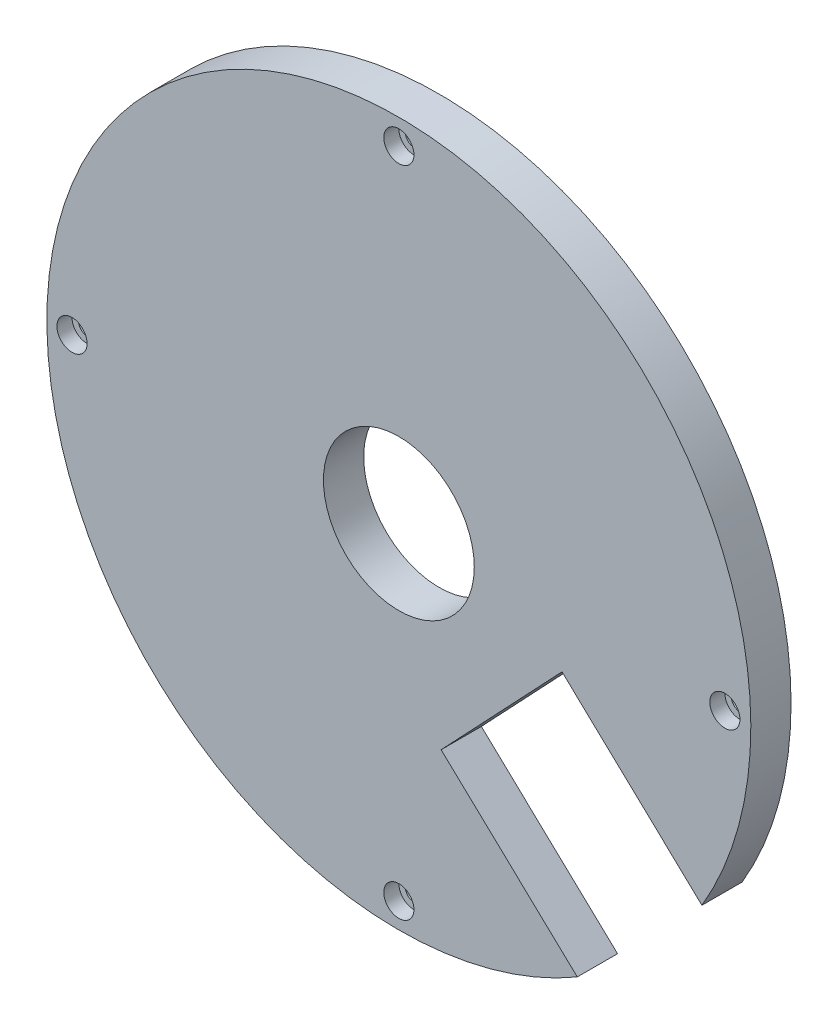
from build123d import *

# Parameters (mm, degrees)
SKIZZE1_R                       = 70
SKIZZE1_R_2                     = 15
AUFSATZ_LINEAR_AUSTRAGEN1_DEPTH = 8
SKIZZE2_R                       = 1.7
SCHNITT_LINEAR_AUSTRAGEN1_DEPTH = 8
SKIZZE3_R                       = 3
SCHNITT_LINEAR_AUSTRAGEN2_DEPTH = 3
SCHNITT_LINEAR_AUSTRAGEN3_DEPTH = 8


with BuildPart() as part:
    # Skizze1 → Aufsatz-Linear austragen1 (new body)
    with BuildSketch(Plane(origin=(0, 0, 0), x_dir=(0, 1, 0), z_dir=(0, 0, 1))):
        with Locations(Location((0, 0, 0), (0, 0, 270))):
            Circle(SKIZZE1_R)
        with Locations(Location((0, 0, 0), (0, 0, 270))):
            Circle(SKIZZE1_R_2, mode=Mode.SUBTRACT)
    extrude(amount=AUFSATZ_LINEAR_AUSTRAGEN1_DEPTH)

    # Skizze2 → Schnitt-Linear austragen1 (cut)
    with BuildSketch(Plane.XY.offset(8)):
        with Locations((0, 65)):
            Circle(SKIZZE2_R)
        with Locations((64.837196687, 0.18986002)):
            Circle(SKIZZE2_R)
        with Locations((0, -65)):
            Circle(SKIZZE2_R)
        with Locations((-65, 0)):
            Circle(SKIZZE2_R)
    extrude(amount=-SCHNITT_LINEAR_AUSTRAGEN1_DEPTH, mode=Mode.SUBTRACT)

    # Skizze3 → Schnitt-Linear austragen2 (cut)
    with BuildSketch(Plane.XY.offset(8)):
        with Locations((0, 65)):
            Circle(SKIZZE3_R)
        with Locations((64.837196687, 0.18986002)):
            Circle(SKIZZE3_R)
        with Locations((0, -65)):
            Circle(SKIZZE3_R)
        with Locations((-65, 0)):
            Circle(SKIZZE3_R)
    extrude(amount=-SCHNITT_LINEAR_AUSTRAGEN2_DEPTH, mode=Mode.SUBTRACT)

    # Skizze4 → Schnitt-Linear austragen3 (cut)
    with BuildSketch(Plane.XY.offset(8)):
        Polygon((66.550324449, -89.690139622), (8.405353871, -34.743234372), (32.444624917, -9.304809744), (90.589595495, -64.251714994), align=None)
    extrude(amount=-SCHNITT_LINEAR_AUSTRAGEN3_DEPTH, mode=Mode.SUBTRACT)


solid = part.part
